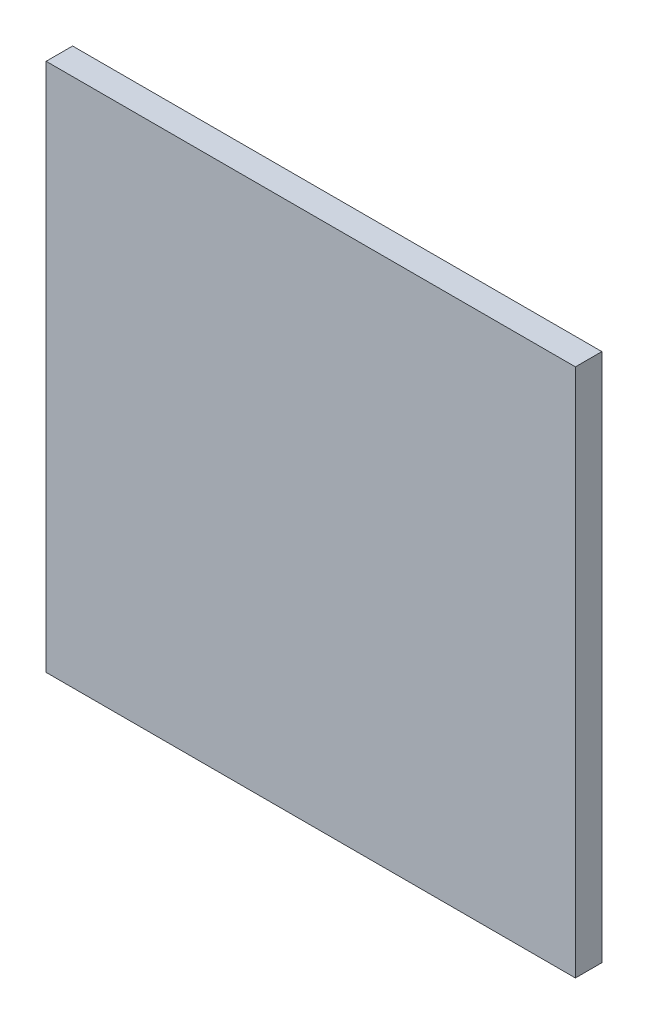
from build123d import *

# Parameters (mm, degrees)
SKETCH1_W           = 50.8
SKETCH1_H           = 50.8
BOSS_EXTRUDE1_DEPTH = 2.54


with BuildPart() as part:
    # Sketch1 → Boss-Extrude1 (new body)
    with BuildSketch(Plane.XY):
        with Locations((25.4, 50.708303249)):
            Rectangle(SKETCH1_W, SKETCH1_H)
    extrude(amount=BOSS_EXTRUDE1_DEPTH)


solid = part.part
